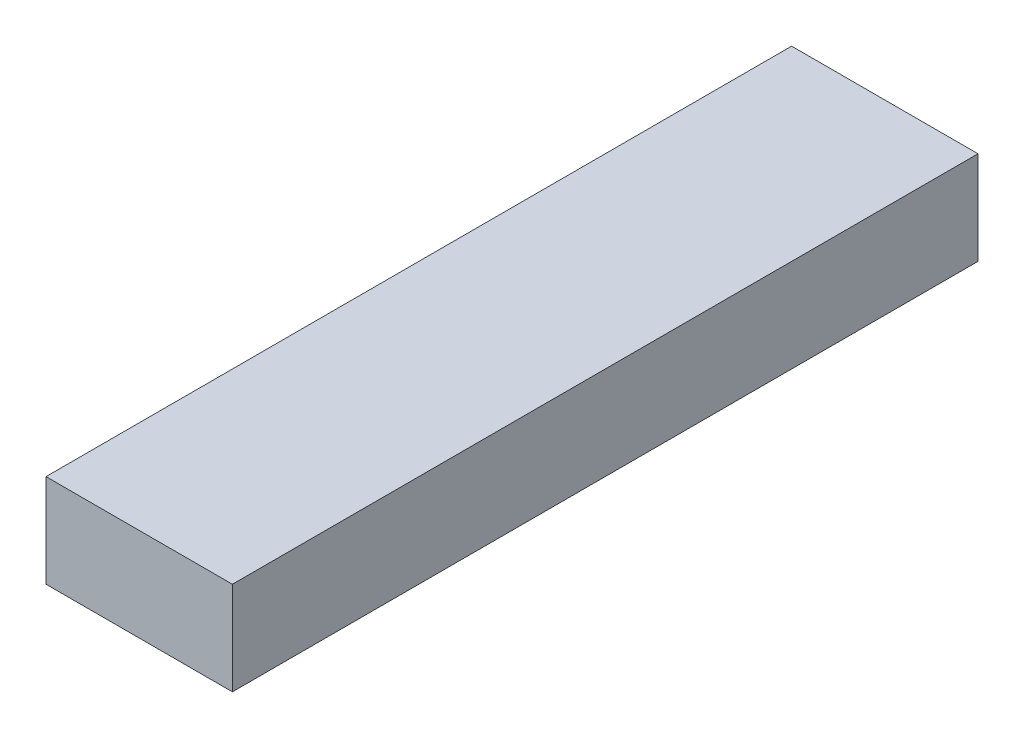
from build123d import *

# Parameters (mm, degrees)
PROFILE1_W = 10
PROFILE1_H = 5


with BuildPart() as part:
    # modern_sweep_rect_baseline: sweep along a path in Path1
    with BuildLine(Plane(origin=(0, 0, 0), x_dir=(0, 0, -1), z_dir=(1, 0, 0))) as modern_sweep_rect_baseline_path:
        Line((0, 0), (-40, 0))
    # Profile1 → modern_sweep_rect_baseline (sweep)
    with BuildSketch(Plane.XY):
        Rectangle(PROFILE1_W, PROFILE1_H)
    sweep(path=modern_sweep_rect_baseline_path.line)


solid = part.part
